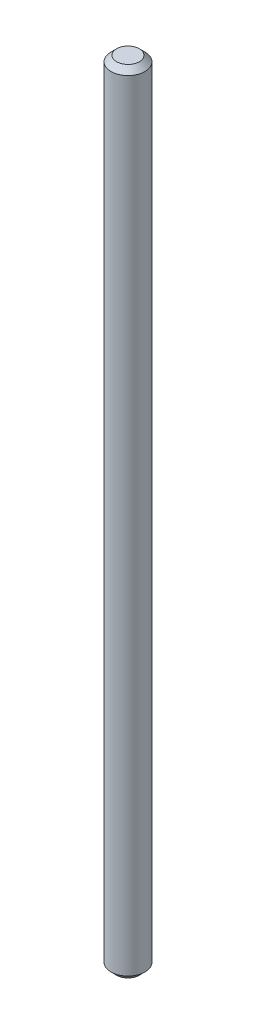
from build123d import *

# Parameters (mm, degrees)
SKETCH1_R           = 3
BOSS_EXTRUDE1_DEPTH = 140
CHAMFER1_SIZE       = 1


with BuildPart() as part:
    # Sketch1 → Boss-Extrude1 (new body)
    with BuildSketch(Plane(origin=(0, 0, 0), x_dir=(1, 0, 0), z_dir=(0, 1, 0))):
        with Locations(Location((0, 0, 0), (0, 0, 270))):
            Circle(SKETCH1_R)
    extrude(amount=BOSS_EXTRUDE1_DEPTH)

    # Chamfer1
    chamfer1_edges = [part.edges().sort_by_distance(p)[0] for p in [
        (0, 0, -3),
        (0, 140, -3),
    ]]
    chamfer(chamfer1_edges, length=CHAMFER1_SIZE)


solid = part.part
